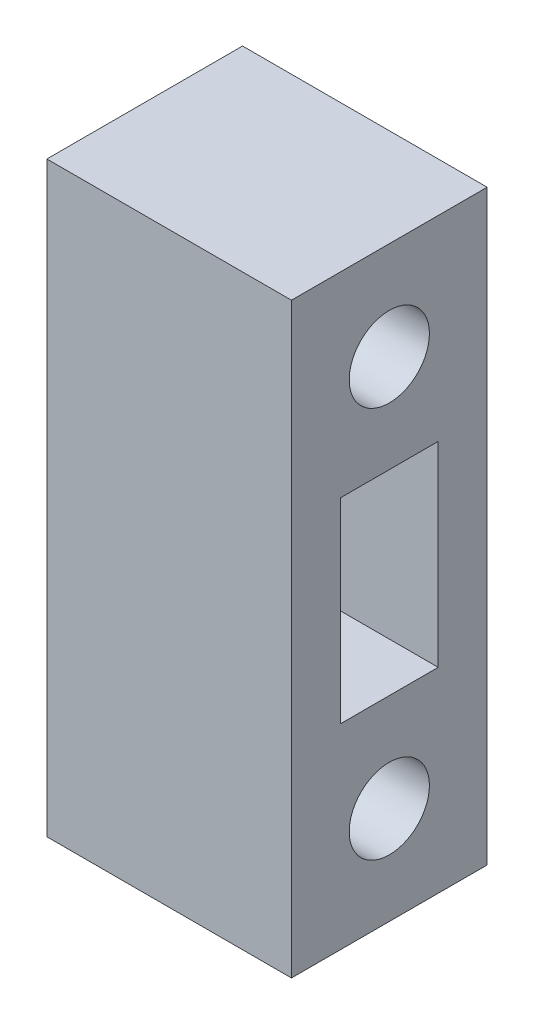
from build123d import *

# Parameters (mm, degrees)
SKETCH1_W           = 20
SKETCH1_H           = 60
SKETCH1_R           = 4.1
SKETCH1_W_2         = 10
SKETCH1_H_2         = 20
BOSS_EXTRUDE1_DEPTH = 25


with BuildPart() as part:
    # Sketch1 → Boss-Extrude1 (new body)
    with BuildSketch(Plane(origin=(0, 0, 0), x_dir=(0, 0, -1), z_dir=(1, 0, 0))):
        Rectangle(SKETCH1_W, SKETCH1_H)
        with Locations((0, 20)):
            Circle(SKETCH1_R, mode=Mode.SUBTRACT)
        with Locations((0, -20)):
            Circle(SKETCH1_R, mode=Mode.SUBTRACT)
        Rectangle(SKETCH1_W_2, SKETCH1_H_2, mode=Mode.SUBTRACT)
    extrude(amount=BOSS_EXTRUDE1_DEPTH)


solid = part.part
